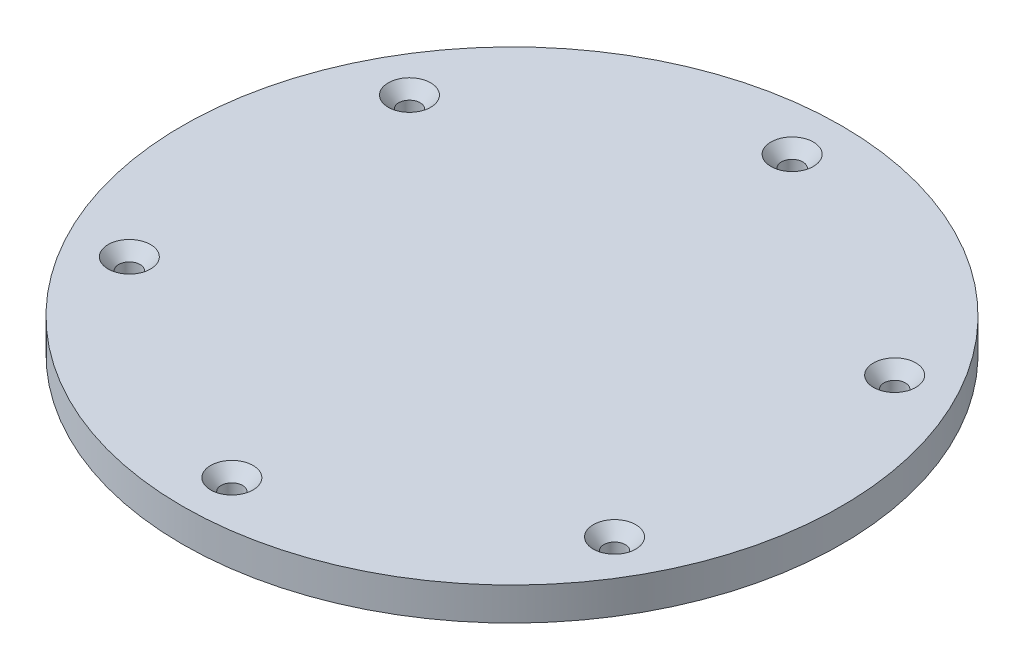
from build123d import *

# Parameters (mm, degrees)
SKETCH1_R                                        = 100
BOSS_EXTRUDE1_DEPTH                              = 10
CSK_FOR_1_4_FLAT_HEAD_MACHINE_SCREW1_D           = 6.5278
CSK_FOR_1_4_FLAT_HEAD_MACHINE_SCREW1_DEPTH       = 10
CSK_FOR_1_4_FLAT_HEAD_MACHINE_SCREW1_CSINK_D     = 12.8778
CSK_FOR_1_4_FLAT_HEAD_MACHINE_SCREW1_CSINK_ANGLE = 82
CSK_FOR_1_4_FLAT_HEAD_MACHINE_SCREW1_TIP         = 1.961148974


with BuildPart() as part:
    # Sketch1 → Boss-Extrude1 (new body)
    with BuildSketch(Plane(origin=(0, 0, 0), x_dir=(1, 0, 0), z_dir=(0, 1, 0))):
        with Locations(Location((0, 0, 0), (0, 0, 270))):
            Circle(SKETCH1_R)
    extrude(amount=BOSS_EXTRUDE1_DEPTH)

    # CSK for 1/4 Flat Head Machine Screw1
    with Locations(Plane(origin=(0, 10, 0), x_dir=(1, 0, 0), z_dir=(0, 1, 0))):
        with Locations((-73.612159322, 42.5), (0, 85), (73.612159322, 42.5), (73.612159322, -42.5), (0, -85), (-73.612159322, -42.5)):
            CounterSinkHole(CSK_FOR_1_4_FLAT_HEAD_MACHINE_SCREW1_D / 2, CSK_FOR_1_4_FLAT_HEAD_MACHINE_SCREW1_CSINK_D / 2, depth=CSK_FOR_1_4_FLAT_HEAD_MACHINE_SCREW1_DEPTH, counter_sink_angle=CSK_FOR_1_4_FLAT_HEAD_MACHINE_SCREW1_CSINK_ANGLE)
            with Locations((0, 0, -(CSK_FOR_1_4_FLAT_HEAD_MACHINE_SCREW1_DEPTH + CSK_FOR_1_4_FLAT_HEAD_MACHINE_SCREW1_TIP / 2))):  # 118° drill point
                Cone(0, CSK_FOR_1_4_FLAT_HEAD_MACHINE_SCREW1_D / 2, CSK_FOR_1_4_FLAT_HEAD_MACHINE_SCREW1_TIP, mode=Mode.SUBTRACT)


solid = part.part
